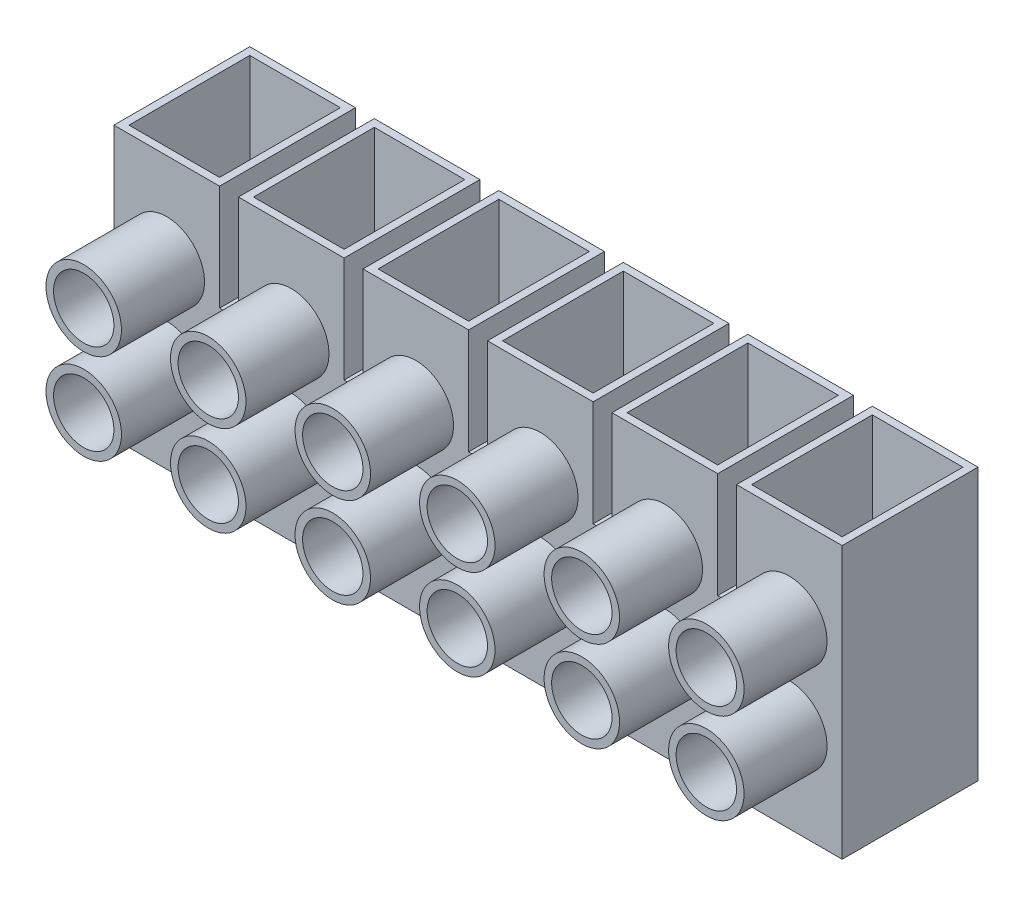
from build123d import *

# Parameters (mm, degrees)
CROQUIS1_W                = 7
CROQUIS1_H                = 18
SALIENTE_EXTRUIR1_DEPTH   = 9
SALIENTE_EXTRUIR1_2_DEPTH = 9
SALIENTE_EXTRUIR1_3_DEPTH = 9
SALIENTE_EXTRUIR1_4_DEPTH = 9
SALIENTE_EXTRUIR1_5_DEPTH = 9
SALIENTE_EXTRUIR1_6_DEPTH = 9
CROQUIS2_W                = 48.25
CROQUIS2_H                = 4
SALIENTE_EXTRUIR2_DEPTH   = 9
CROQUIS3_R                = 2.5
CROQUIS3_R_2              = 2
SALIENTE_EXTRUIR3_DEPTH   = 5.5
CROQUIS4_R                = 1
CORTAR_EXTRUIR1_DEPTH     = 53.278700252
CROQUIS5_W                = 6
CROQUIS5_H                = 8
CORTAR_EXTRUIR2_DEPTH     = 54.500584109


with BuildPart() as part:
    # Croquis1 → Saliente-Extruir1 (new body)
    with BuildSketch(Plane.XY):
        with Locations((11.75, 9)):
            Rectangle(CROQUIS1_W, CROQUIS1_H)
    extrude(amount=SALIENTE_EXTRUIR1_DEPTH)



with BuildPart() as body_2:
    # Croquis1 → Saliente-Extruir1 2 (new body)
    with BuildSketch(Plane.XY):
        with Locations((3.5, 9)):
            Rectangle(CROQUIS1_W, CROQUIS1_H)
    extrude(amount=SALIENTE_EXTRUIR1_2_DEPTH)


with BuildPart() as body_3:
    # Croquis1 → Saliente-Extruir1 3 (new body)
    with BuildSketch(Plane.XY):
        with Locations((20, 9)):
            Rectangle(CROQUIS1_W, CROQUIS1_H)
    extrude(amount=SALIENTE_EXTRUIR1_3_DEPTH)


with BuildPart() as body_4:
    # Croquis1 → Saliente-Extruir1 4 (new body)
    with BuildSketch(Plane.XY):
        with Locations((28.25, 9)):
            Rectangle(CROQUIS1_W, CROQUIS1_H)
    extrude(amount=SALIENTE_EXTRUIR1_4_DEPTH)


with BuildPart() as body_5:
    # Croquis1 → Saliente-Extruir1 5 (new body)
    with BuildSketch(Plane.XY):
        with Locations((36.5, 9)):
            Rectangle(CROQUIS1_W, CROQUIS1_H)
    extrude(amount=SALIENTE_EXTRUIR1_5_DEPTH)


with BuildPart() as body_6:
    # Croquis1 → Saliente-Extruir1 6 (new body)
    with BuildSketch(Plane.XY):
        with Locations((44.75, 9)):
            Rectangle(CROQUIS1_W, CROQUIS1_H)
    extrude(amount=SALIENTE_EXTRUIR1_6_DEPTH)


with BuildPart() as part_1:
    add(part.part)

    add(body_2.part)  # Saliente-Extruir2 merges body 2

    add(body_3.part)  # Saliente-Extruir2 merges body 3

    add(body_4.part)  # Saliente-Extruir2 merges body 4

    add(body_5.part)  # Saliente-Extruir2 merges body 5

    add(body_6.part)  # Saliente-Extruir2 merges body 6
    # Croquis2 → Saliente-Extruir2 (add)
    with BuildSketch(Plane.XY):
        with Locations((24.125, 9)):
            Rectangle(CROQUIS2_W, CROQUIS2_H)
    extrude(amount=SALIENTE_EXTRUIR2_DEPTH)

    # Croquis3 → Saliente-Extruir3 (add)
    # profile 1 of 12: a face of its own
    with BuildSketch(Plane.XY.offset(9)):
        with Locations(Location((3.5, 12, 0), (0, 0, 180))):
            Circle(CROQUIS3_R)
        with Locations((3.5, 12)):
            Circle(CROQUIS3_R_2, mode=Mode.SUBTRACT)
    # profile 2 of 12: a face of its own
    with BuildSketch(Plane.XY.offset(9)):
        with Locations(Location((11.75, 12, 0), (0, 0, 180))):
            Circle(CROQUIS3_R)
        with Locations((11.75, 12)):
            Circle(CROQUIS3_R_2, mode=Mode.SUBTRACT)
    # profile 3 of 12: a face of its own
    with BuildSketch(Plane.XY.offset(9)):
        with Locations(Location((20, 12, 0), (0, 0, 180))):
            Circle(CROQUIS3_R)
        with Locations((20, 12)):
            Circle(CROQUIS3_R_2, mode=Mode.SUBTRACT)
    # profile 4 of 12: a face of its own
    with BuildSketch(Plane.XY.offset(9)):
        with Locations(Location((28.25, 12, 0), (0, 0, 180))):
            Circle(CROQUIS3_R)
        with Locations((28.25, 12)):
            Circle(CROQUIS3_R_2, mode=Mode.SUBTRACT)
    # profile 5 of 12: a face of its own
    with BuildSketch(Plane.XY.offset(9)):
        with Locations(Location((36.5, 12, 0), (0, 0, 180))):
            Circle(CROQUIS3_R)
        with Locations((36.5, 12)):
            Circle(CROQUIS3_R_2, mode=Mode.SUBTRACT)
    # profile 6 of 12: a face of its own
    with BuildSketch(Plane.XY.offset(9)):
        with Locations(Location((44.75, 12, 0), (0, 0, 180))):
            Circle(CROQUIS3_R)
        with Locations((44.75, 12)):
            Circle(CROQUIS3_R_2, mode=Mode.SUBTRACT)
    # profile 7 of 12: a face of its own
    with BuildSketch(Plane.XY.offset(9)):
        with Locations(Location((11.75, 6, 0), (0, 0, 180))):
            Circle(CROQUIS3_R)
        with Locations((11.75, 6)):
            Circle(CROQUIS3_R_2, mode=Mode.SUBTRACT)
    # profile 8 of 12: a face of its own
    with BuildSketch(Plane.XY.offset(9)):
        with Locations(Location((20, 6, 0), (0, 0, 180))):
            Circle(CROQUIS3_R)
        with Locations((20, 6)):
            Circle(CROQUIS3_R_2, mode=Mode.SUBTRACT)
    # profile 9 of 12: a face of its own
    with BuildSketch(Plane.XY.offset(9)):
        with Locations(Location((28.25, 6, 0), (0, 0, 180))):
            Circle(CROQUIS3_R)
        with Locations((28.25, 6)):
            Circle(CROQUIS3_R_2, mode=Mode.SUBTRACT)
    # profile 10 of 12: a face of its own
    with BuildSketch(Plane.XY.offset(9)):
        with Locations(Location((36.5, 6, 0), (0, 0, 180))):
            Circle(CROQUIS3_R)
        with Locations((36.5, 6)):
            Circle(CROQUIS3_R_2, mode=Mode.SUBTRACT)
    # profile 11 of 12: a face of its own
    with BuildSketch(Plane.XY.offset(9)):
        with Locations(Location((44.75, 6, 0), (0, 0, 180))):
            Circle(CROQUIS3_R)
        with Locations((44.75, 6)):
            Circle(CROQUIS3_R_2, mode=Mode.SUBTRACT)
    # profile 12 of 12: a face of its own
    with BuildSketch(Plane.XY.offset(9)):
        with Locations(Location((3.5, 6, 0), (0, 0, 180))):
            Circle(CROQUIS3_R)
        with Locations((3.5, 6)):
            Circle(CROQUIS3_R_2, mode=Mode.SUBTRACT)
    extrude(amount=SALIENTE_EXTRUIR3_DEPTH)

    # Croquis4 → Cortar-Extruir1 (cut, through all)
    with BuildSketch(Plane.XY.offset(9)):
        with Locations((7.625, 9)):
            Circle(CROQUIS4_R)
        with Locations((15.875, 9)):
            Circle(CROQUIS4_R)
        with Locations((24.125, 9)):
            Circle(CROQUIS4_R)
        with Locations((32.375, 9)):
            Circle(CROQUIS4_R)
        with Locations((40.625, 9)):
            Circle(CROQUIS4_R)
    extrude(amount=-CORTAR_EXTRUIR1_DEPTH, mode=Mode.SUBTRACT)

    # Croquis5 → Cortar-Extruir2 (cut, through all)
    with BuildSketch(Plane.XZ):
        with Locations((3.5, 4.5)):
            Rectangle(CROQUIS5_W, CROQUIS5_H)
        with Locations((11.75, 4.5)):
            Rectangle(CROQUIS5_W, CROQUIS5_H)
        with Locations((20, 4.5)):
            Rectangle(CROQUIS5_W, CROQUIS5_H)
        with Locations((28.25, 4.5)):
            Rectangle(CROQUIS5_W, CROQUIS5_H)
        with Locations((36.5, 4.5)):
            Rectangle(CROQUIS5_W, CROQUIS5_H)
        with Locations((44.75, 4.5)):
            Rectangle(CROQUIS5_W, CROQUIS5_H)
    extrude(amount=-CORTAR_EXTRUIR2_DEPTH, mode=Mode.SUBTRACT)


solid = part_1.part
